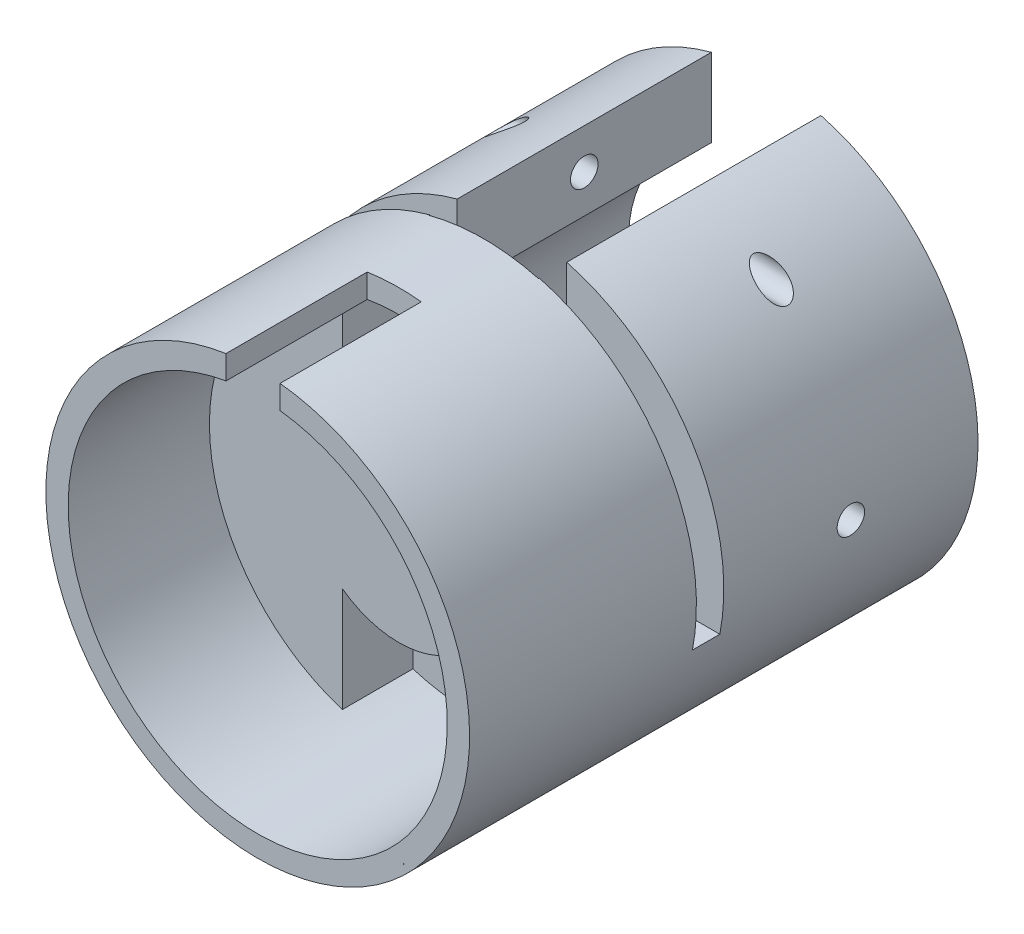
from build123d import *

# Parameters (mm, degrees)
SKETCH1_R               = 15
BOSS_EXTRUDE2_DEPTH     = 5
SKETCH10_R              = 0.026716532
BOSS_EXTRUDE10_DEPTH    = 10
BOSS_EXTRUDE13_START    = 1
SKETCH12_R              = 15
BOSS_EXTRUDE13_DEPTH    = 1
BOSS_EXTRUDE14_START    = 20
BOSS_EXTRUDE14_DEPTH    = 20
SKETCH15_W              = 30
SKETCH15_H              = 1.939892957
CUT_EXTRUDE1_DEPTH      = 19
CUT_EXTRUDE2_DEPTH      = 32.478739146
CUT_EXTRUDE2_DEPTH_BACK = 32.478739146
SKETCH16_R              = 0.975
CUT_EXTRUDE3_DEPTH      = 32.47873926
CUT_EXTRUDE3_DEPTH_BACK = 32.47873926
SKETCH17_R              = 0.975


with BuildPart() as part:
    # Sketch1 → Boss-Extrude2 (new body)
    with BuildSketch(Plane.XY):
        with Locations((0.153154005, 2.896729922)):
            Circle(SKETCH1_R)
        with BuildLine():
            Line((-3.858366409, 8.353410796), (-3.858366409, 15.623324251))
            ThreePointArc((-3.858366409, 15.623324251), (0.153154005, 16.236968805), (4.164674419, 15.623324251))
            Line((4.164674419, 15.623324251), (4.164674419, 8.353410796))
            ThreePointArc((4.164674419, 8.353410796), (0.153154005, 9.669296806), (-3.858366409, 8.353410796))
        make_face(mode=Mode.SUBTRACT)
        with BuildLine():
            Line((-3.858366409, -2.559950952), (-3.858366409, -9.987163584))
            ThreePointArc((-3.858366409, -9.987163584), (0.153154005, -10.600808139), (4.164674419, -9.987163584))
            Line((4.164674419, -9.987163584), (4.164674419, -2.559950952))
            ThreePointArc((4.164674419, -2.559950952), (0.153154005, -3.875836962), (-3.858366409, -2.559950952))
        make_face(mode=Mode.SUBTRACT)
    extrude(amount=BOSS_EXTRUDE2_DEPTH)

    # Sketch10 → Boss-Extrude10 (add)
    with BuildSketch(Plane.XY.offset(5)):
        with BuildLine():
            Line((-2.094128576, 16.047452534), (-2.094128576, 17.727431895))
            ThreePointArc((-2.094128576, 17.727431895), (-9.62669163, -8.476687302), (15.153154005, 2.896729922))
            ThreePointArc((15.153154005, 2.896729922), (11.304753393, 12.928770148), (1.734243192, 17.813169074))
            Line((1.734243192, 17.813169074), (1.734243192, 16.14349683))
            ThreePointArc((1.734243192, 16.14349683), (2.961528164, 15.939802873), (4.164674419, 15.623324251))
            ThreePointArc((4.164674419, 15.623324251), (13.572042477, 2.818080333), (4.164674419, -9.987163584))
            ThreePointArc((4.164674419, -9.987163584), (0.153154005, -10.600808139), (-3.858366409, -9.987163584))
            ThreePointArc((-3.858366409, -9.987163584), (-13.265734467, 2.818080333), (-3.858366409, 15.623324251))
            ThreePointArc((-3.858366409, 15.623324251), (-2.983424534, 15.865242588), (-2.094128576, 16.047452534))
        make_face()
        with Locations((10.491847297, -7.276178058)):
            Circle(SKETCH10_R, mode=Mode.SUBTRACT)
    extrude(amount=BOSS_EXTRUDE10_DEPTH)

    # Sketch12 → Boss-Extrude13 (add)
    with BuildSketch(Plane(origin=(0, 0, 0), x_dir=(-1, 0, 0), z_dir=(0, 0, -1)).offset(BOSS_EXTRUDE13_START)):
        with Locations((-0.153154005, 2.896729922)):
            Circle(SKETCH12_R)
    extrude(amount=-BOSS_EXTRUDE13_DEPTH)

    # Sketch13 → Boss-Extrude14 (add)
    with BuildSketch(Plane(origin=(0, 0, -1), x_dir=(-1, 0, 0), z_dir=(0, 0, -1)).offset(BOSS_EXTRUDE14_START)):
        with BuildLine():
            ThreePointArc((9.596845995, 2.896729922), (-5.50307382, -5.254396256), (-4.032047949, 11.841934323))
            Line((-4.032047949, 11.841934323), (-4.032047949, 17.386525703))
            ThreePointArc((-4.032047949, 17.386525703), (-9.285968216, -9.002501338), (14.846845995, 2.896729922))
            ThreePointArc((14.846845995, 2.896729922), (11.746077255, 12.029544133), (3.725739939, 17.386525703))
            Line((3.725739939, 17.386525703), (3.725739939, 11.841934323))
            ThreePointArc((3.725739939, 11.841934323), (7.997972173, 8.246649737), (9.596845995, 2.896729922))
        make_face()
    extrude(amount=-BOSS_EXTRUDE14_DEPTH)

    # Sketch15 → Cut-Extrude1 (cut)
    with BuildSketch(Plane(origin=(0, 0, 0), x_dir=(1, 0, 0), z_dir=(0, 1, 0))):
        with Locations((0.153154005, 2.030053522)):
            Rectangle(SKETCH15_W, SKETCH15_H)
    extrude(amount=CUT_EXTRUDE1_DEPTH, mode=Mode.SUBTRACT)

    # Sketch16 → Cut-Extrude2 (cut, two sides: drawn at the far end of the back side and taken through both)
    with BuildSketch(Plane(origin=(0, 0, 0), x_dir=(0, 0, -1), z_dir=(1, 0, 0)).offset(-CUT_EXTRUDE2_DEPTH_BACK)):
        with Locations((12, 14.550017205)):
            Circle(SKETCH16_R)
    extrude(amount=CUT_EXTRUDE2_DEPTH + CUT_EXTRUDE2_DEPTH_BACK, mode=Mode.SUBTRACT)

    # Sketch17 → Cut-Extrude3 (cut, two sides: drawn at the far end of the back side and taken through both)
    with BuildSketch(Plane(origin=(0, 0, 0), x_dir=(0, 0, -1), z_dir=(1, 0, 0)).offset(-CUT_EXTRUDE3_DEPTH_BACK)):
        with Locations((12, 2.641627812)):
            Circle(SKETCH17_R)
    extrude(amount=CUT_EXTRUDE3_DEPTH + CUT_EXTRUDE3_DEPTH_BACK, mode=Mode.SUBTRACT)


solid = part.part
